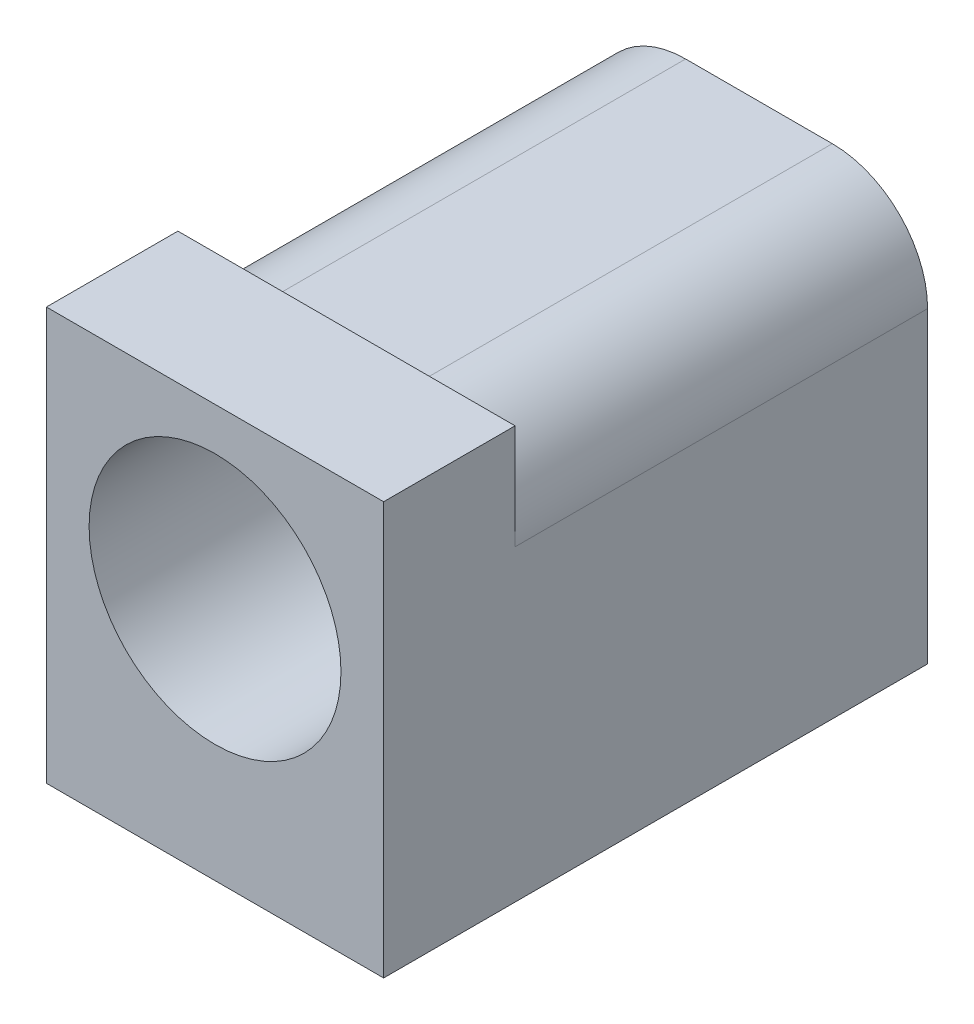
from build123d import *

# Parameters (mm, degrees)
SKETCH1_W           = 8.9916
SKETCH1_H           = 14.5034
BOSS_EXTRUDE1_DEPTH = 10.9982
SKETCH2_R           = 3.357740144
CUT_EXTRUDE1_DEPTH  = 11.43
SKETCH3_W           = 8.9916
SKETCH3_H           = 10.9982
CUT_EXTRUDE2_DEPTH  = 0.254
FILLET1_R           = 2.54
FILLET2_R           = 2.54


with BuildPart() as part:
    # Sketch1 → Boss-Extrude1 (new body)
    with BuildSketch(Plane(origin=(0, 0, 0), x_dir=(1, 0, 0), z_dir=(0, 1, 0))):
        with Locations((4.4958, 7.2517)):
            Rectangle(SKETCH1_W, SKETCH1_H)
    extrude(amount=BOSS_EXTRUDE1_DEPTH)

    # Sketch2 → Cut-Extrude1 (cut)
    with BuildSketch(Plane.XY):
        with Locations((4.4958, 6.5024)):
            Circle(SKETCH2_R)
    extrude(amount=-CUT_EXTRUDE1_DEPTH, mode=Mode.SUBTRACT)

    # Sketch3 → Cut-Extrude2 (cut)
    with BuildSketch(Plane(origin=(0, 10.9982, 0), x_dir=(1, 0, 0), z_dir=(0, 1, 0))):
        with Locations((4.4958, 9.0043)):
            Rectangle(SKETCH3_W, SKETCH3_H)
    extrude(amount=-CUT_EXTRUDE2_DEPTH, mode=Mode.SUBTRACT)

    # Fillet1
    fillet1_edges = [part.edges().sort_by_distance(p)[0] for p in [
        (8.9916, 10.7442, -9.0043),
    ]]
    fillet(fillet1_edges, radius=FILLET1_R)

    # Fillet2
    fillet2_edges = [part.edges().sort_by_distance(p)[0] for p in [
        (0, 10.7442, -9.0043),
    ]]
    fillet(fillet2_edges, radius=FILLET2_R)


solid = part.part
